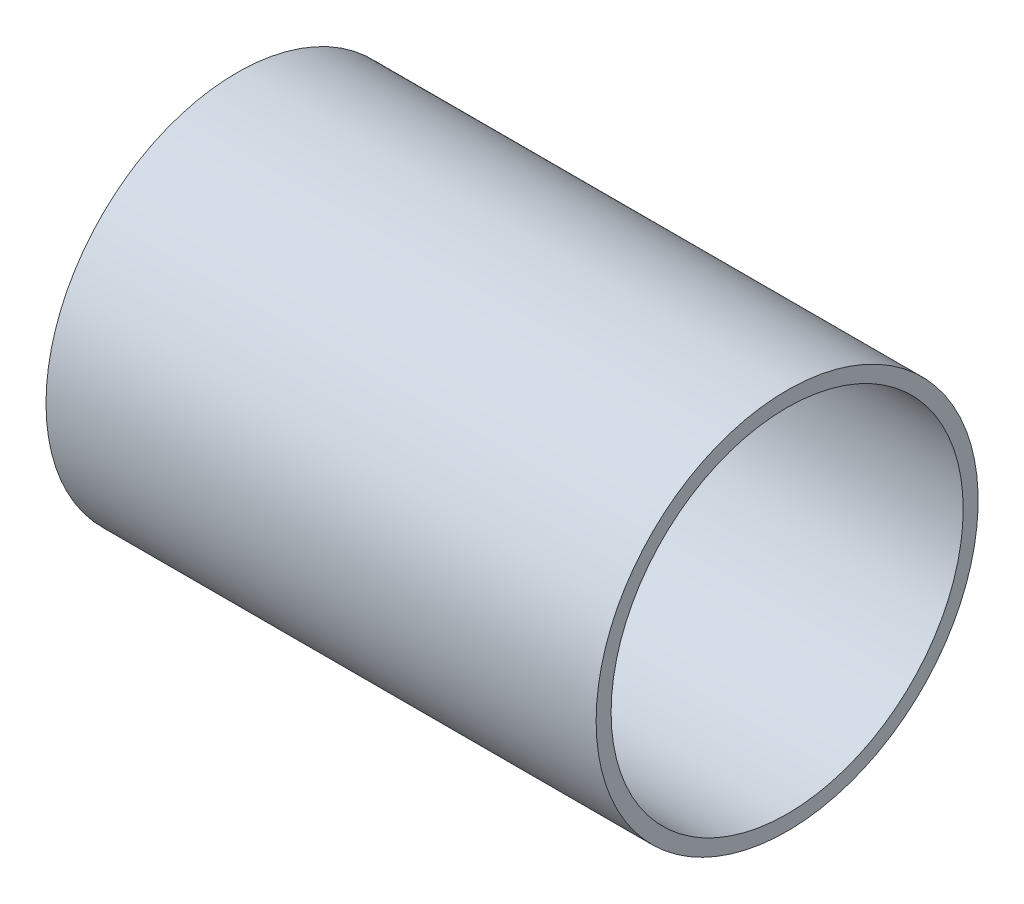
from build123d import *

# Parameters (mm, degrees)
SKETCH1_W = 45.72
SKETCH1_H = 1.2446


with BuildPart() as part:
    # Sketch1 → Revolve1 (revolve)
    with BuildSketch(Plane(origin=(0, 0, 0), x_dir=(1, 0, 0), z_dir=(0, 1, 0)), mode=Mode.PRIVATE) as revolve1_sk:
        with Locations((0, 15.2527)):
            Rectangle(SKETCH1_W, SKETCH1_H)
    revolve(revolve1_sk.sketch.rotate(Axis((-72.893991897, 0, 0), (1, 0, 0)), 180), axis=Axis((-72.893991897, 0, 0), (1, 0, 0)))


solid = part.part
